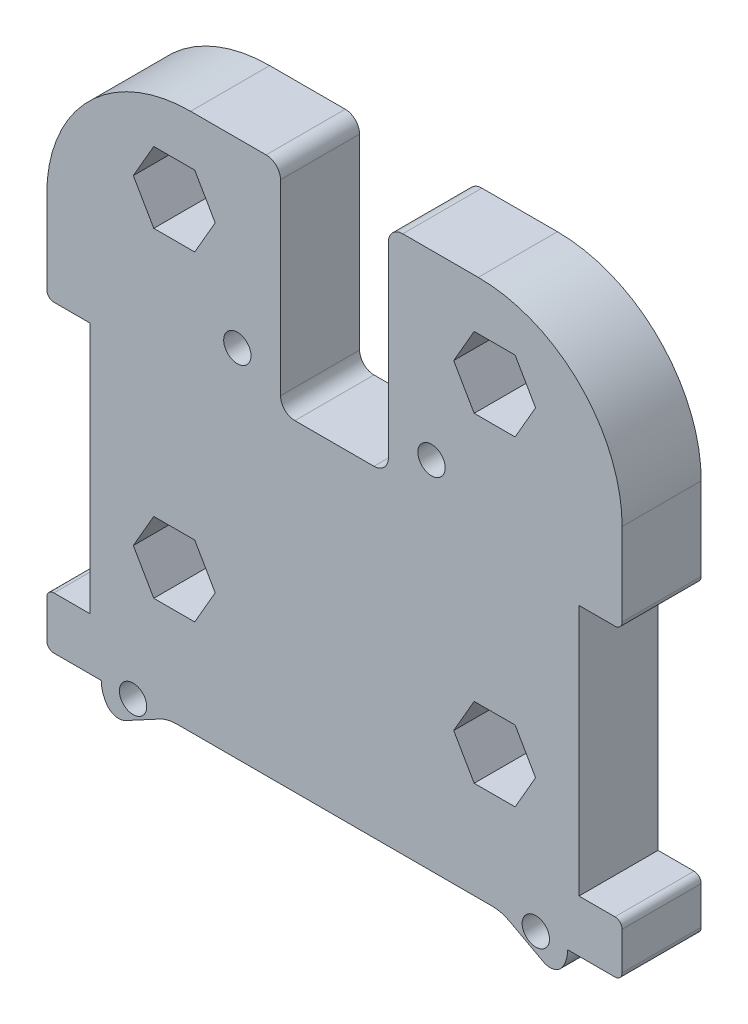
from build123d import *

# Parameters (mm, degrees)
SKETCH_1_W                   = 80
SKETCH_1_H                   = 100
EXTRUDE_1_DEPTH              = 11
SKETCH_7_W                   = 15
SKETCH_7_H                   = 30
CUT_EXTRUDE_1_DEPTH          = 16
HOLE_WIZARD_M4_1_D           = 3.3
HOLE_WIZARD_M4_1_CSINK_D     = 4.05
HOLE_WIZARD_M4_1_CSINK_ANGLE = 90
FILLET_1_R                   = 20
FILLET_2_R                   = 2
SKETCH_9_W                   = 6
SKETCH_9_H                   = 35
CUT_EXTRUDE_2_DEPTH          = 11
SKETCH_11_R                  = 3
CUT_EXTRUDE_4_DEPTH          = 15
SKETCH_12_R                  = 3.43
CUT_EXTRUDE_5_DEPTH          = 3.9
CUT_EXTRUDE_6_DEPTH          = 8.5
CUT_EXTRUDE_7_DEPTH          = 14
SKETCH_15_R                  = 1.9
CUT_EXTRUDE_8_DEPTH          = 14
FILLET_4_R                   = 0.12
FILLET_5_R                   = 1


with BuildPart() as part:
    # 草图1 → 凸台-拉伸1 (new body)
    with BuildSketch(Plane.XY):
        Rectangle(SKETCH_1_W, SKETCH_1_H)
    extrude(amount=EXTRUDE_1_DEPTH)

    # 草图7 → 切除-拉伸1 (cut)
    with BuildSketch(Plane.XY.offset(11)):
        with Locations((0, 35)):
            Rectangle(SKETCH_7_W, SKETCH_7_H)
    extrude(amount=-CUT_EXTRUDE_1_DEPTH, mode=Mode.SUBTRACT)

    # M4 螺纹孔1 (through all)
    with Locations(Plane(origin=(13.5, 24.75, 0), x_dir=(-1, 0, 0), z_dir=(0, 0, -1))):
        with Locations((0, 0), (27, 0), (41.5, -49.5), (-14.5, -49.5)):
            CounterSinkHole(HOLE_WIZARD_M4_1_D / 2, HOLE_WIZARD_M4_1_CSINK_D / 2, counter_sink_angle=HOLE_WIZARD_M4_1_CSINK_ANGLE)

    # 圆角1
    fillet_1_edges = [part.edges().sort_by_distance(p)[0] for p in [
        (-40, 50, 5.5),
        (40, 50, 5.5),
    ]]
    fillet(fillet_1_edges, radius=FILLET_1_R)

    # 圆角2
    fillet_2_edges = [part.edges().sort_by_distance(p)[0] for p in [
        (-7.5, 20, 5.5),
        (-7.5, 50, 5.5),
        (7.5, 50, 5.5),
        (7.5, 20, 5.5),
        (40, -50, 5.5),
        (-40, -50, 5.5),
    ]]
    fillet(fillet_2_edges, radius=FILLET_2_R)

    # 草图9 → 切除-拉伸2 (cut)
    with BuildSketch(Plane.XY):
        with Locations((37, 0)):
            Rectangle(SKETCH_9_W, SKETCH_9_H)
        with Locations((-37, 0)):
            Rectangle(SKETCH_9_W, SKETCH_9_H)
    extrude(amount=CUT_EXTRUDE_2_DEPTH, mode=Mode.SUBTRACT)

    # 草图11 → 切除-拉伸4 (cut)
    with BuildSketch(Plane.XY):
        with Locations((-22.273863607, 38.273863607)):
            Circle(SKETCH_11_R)
        with Locations((22.273863607, 38.273863607)):
            Circle(SKETCH_11_R)
        with Locations((22.273863607, -6.273863607)):
            Circle(SKETCH_11_R)
        with Locations((-22.273863607, -6.273863607)):
            Circle(SKETCH_11_R)
    extrude(amount=CUT_EXTRUDE_4_DEPTH, mode=Mode.SUBTRACT)

    # 草图12 → 切除-拉伸5 (cut)
    with BuildSketch(Plane.XY):
        with Locations((13.5, 24.75)):
            Circle(SKETCH_12_R)
        with Locations((28, -24.75)):
            Circle(SKETCH_12_R)
        with Locations(Location((-28, -24.75, 0), (0, 0, 180))):
            Circle(SKETCH_12_R)
        with Locations(Location((-13.5, 24.75, 0), (0, 0, 180))):
            Circle(SKETCH_12_R)
    extrude(amount=CUT_EXTRUDE_5_DEPTH, mode=Mode.SUBTRACT)

    # 草图13 → 切除-拉伸6 (cut)
    with BuildSketch(Plane.XY.offset(11)):
        Polygon((-19.42752678, 33.343863607), (-16.581189953, 38.273863607), (-19.42752678, 43.203863607), (-25.120200434, 43.203863607), (-27.966537262, 38.273863607), (-25.120200434, 33.343863607), align=None)
        Polygon((-19.42752678, -11.203863607), (-16.581189953, -6.273863607), (-19.42752678, -1.343863607), (-25.120200434, -1.343863607), (-27.966537262, -6.273863607), (-25.120200434, -11.203863607), align=None)
        Polygon((25.120200434, -11.203863607), (19.42752678, -11.203863607), (16.581189953, -6.273863607), (19.42752678, -1.343863607), (25.120200434, -1.343863607), (27.966537262, -6.273863607), align=None)
        Polygon((25.120200434, 33.343863607), (19.42752678, 33.343863607), (16.581189953, 38.273863607), (19.42752678, 43.203863607), (25.120200434, 43.203863607), (27.966537262, 38.273863607), align=None)
    extrude(amount=-CUT_EXTRUDE_6_DEPTH, mode=Mode.SUBTRACT)

    # 草图14 → 切除-拉伸7 (cut)
    with BuildSketch(Plane(origin=(0, 0, 0), x_dir=(-1, 0, 0), z_dir=(0, 0, -1))):
        with BuildLine():
            Line((-42.281489137, -24.75), (-32.43, -24.75))
            ThreePointArc((-32.43, -24.75), (-32.229391744, -26.068008147), (-31.645735677, -27.266646852))
            ThreePointArc((-31.645735677, -27.266646852), (-30.468858677, -28.074682546), (-29.053003561, -27.892157349))
            Line((-29.053003561, -27.892157349), (-24.314984036, -25.345764556))
            ThreePointArc((-24.314984036, -25.345764556), (-23.168394001, -24.901228134), (-21.947979567, -24.75))
            Line((-21.947979567, -24.75), (21.947979567, -24.75))
            ThreePointArc((21.947979567, -24.75), (23.168394001, -24.901228134), (24.314984036, -25.345764556))
            Line((24.314984036, -25.345764556), (29.053003561, -27.892157349))
            ThreePointArc((29.053003561, -27.892157349), (30.468858677, -28.074682546), (31.645735677, -27.266646852))
            ThreePointArc((31.645735677, -27.266646852), (32.229391744, -26.068008147), (32.43, -24.75))
            Line((32.43, -24.75), (45.771408099, -24.75))
            Line((45.771408099, -24.75), (45.771408099, -58.548543379))
            Line((45.771408099, -58.548543379), (-42.281489137, -58.548543379))
            Line((-42.281489137, -58.548543379), (-42.281489137, -24.75))
        make_face()
    extrude(amount=-CUT_EXTRUDE_7_DEPTH, mode=Mode.SUBTRACT)

    # 草图15 → 切除-拉伸8 (cut)
    with BuildSketch(Plane.XY.offset(11)):
        with Locations((-13.5, 24.75)):
            Circle(SKETCH_15_R)
        with Locations((-28, -24.75)):
            Circle(SKETCH_15_R)
        with Locations((13.5, 24.75)):
            Circle(SKETCH_15_R)
        with Locations((28, -24.75)):
            Circle(SKETCH_15_R)
    extrude(amount=-CUT_EXTRUDE_8_DEPTH, mode=Mode.SUBTRACT)

    # 圆角4
    fillet_4_edges = [part.edges().sort_by_distance(p)[0] for p in [
        (24.660163825, -25.531277369, 1.95),
        (29.199579974, -27.963395071, 1.95),
        (-29.199579974, -27.963395071, 1.95),
        (-24.660163825, -25.531277369, 1.95),
    ]]
    fillet(fillet_4_edges, radius=FILLET_4_R)

    # 圆角5
    fillet_5_edges = [part.edges().sort_by_distance(p)[0] for p in [
        (40, -17.5, 5.5),
        (40, 17.5, 5.5),
        (-40, 17.5, 5.5),
        (-40, -17.5, 5.5),
        (40, -24.75, 5.5),
        (-40, -24.75, 5.5),
    ]]
    fillet(fillet_5_edges, radius=FILLET_5_R)


solid = part.part
